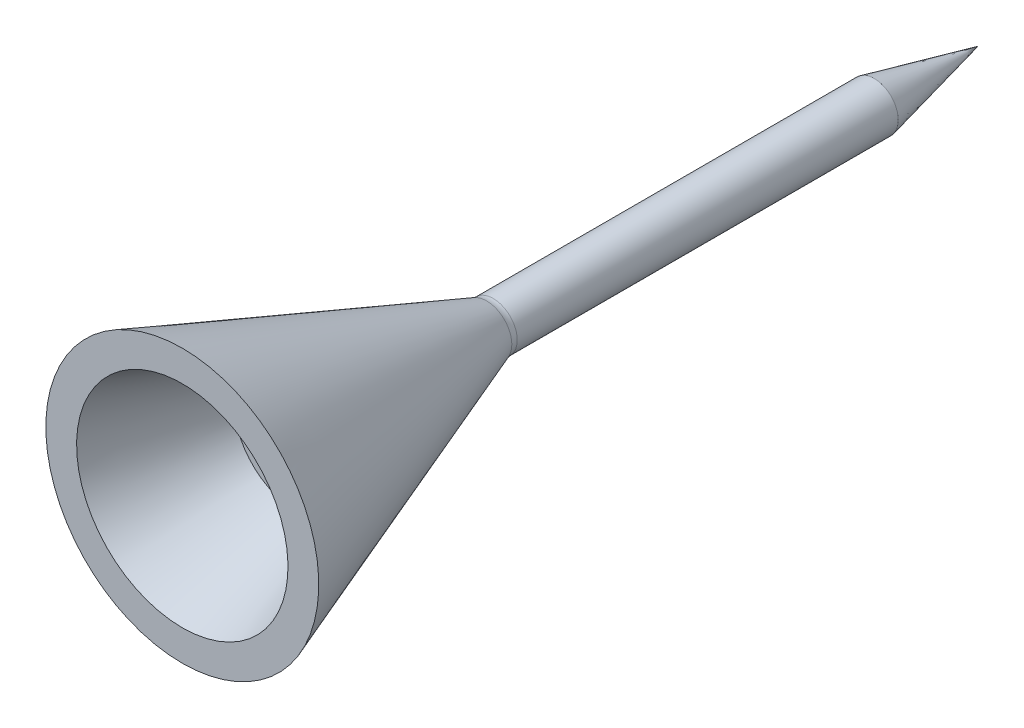
from build123d import *

# Parameters (mm, degrees)
FILLET1_R = 1


with BuildPart() as part:
    # Sketch1 → Revolve1 (revolve)
    with BuildSketch(Plane(origin=(0, 0, 0), x_dir=(0, 0, -1), z_dir=(1, 0, 0)), mode=Mode.PRIVATE) as revolve1_sk:
        Polygon((0, 0), (-4.376068376, 0), (-10, 2.05625), (-16, 4.25), (-16, 5.85), align=None)
        Polygon((-10, 0), (-4.376068376, 0), (-10, 2.05625), align=None)
        Polygon((20, 0), (0, 0), (-4.376068376, 0), (-10, 0), (-10, -1.25), (20, -1.25), align=None)
        Polygon((25.4, -1.25), (20, -1.25), (20, 0), align=None)
    revolve(revolve1_sk.sketch.rotate(Axis((0, -1.25, 10), (0, 0, -1)), 180), axis=Axis((0, -1.25, 10), (0, 0, -1)))

    # Fillet1
    fillet1_edges = [part.edges().sort_by_distance(p)[0] for p in [
        (0, 0, 0),
    ]]
    fillet(fillet1_edges, radius=FILLET1_R)


solid = part.part
